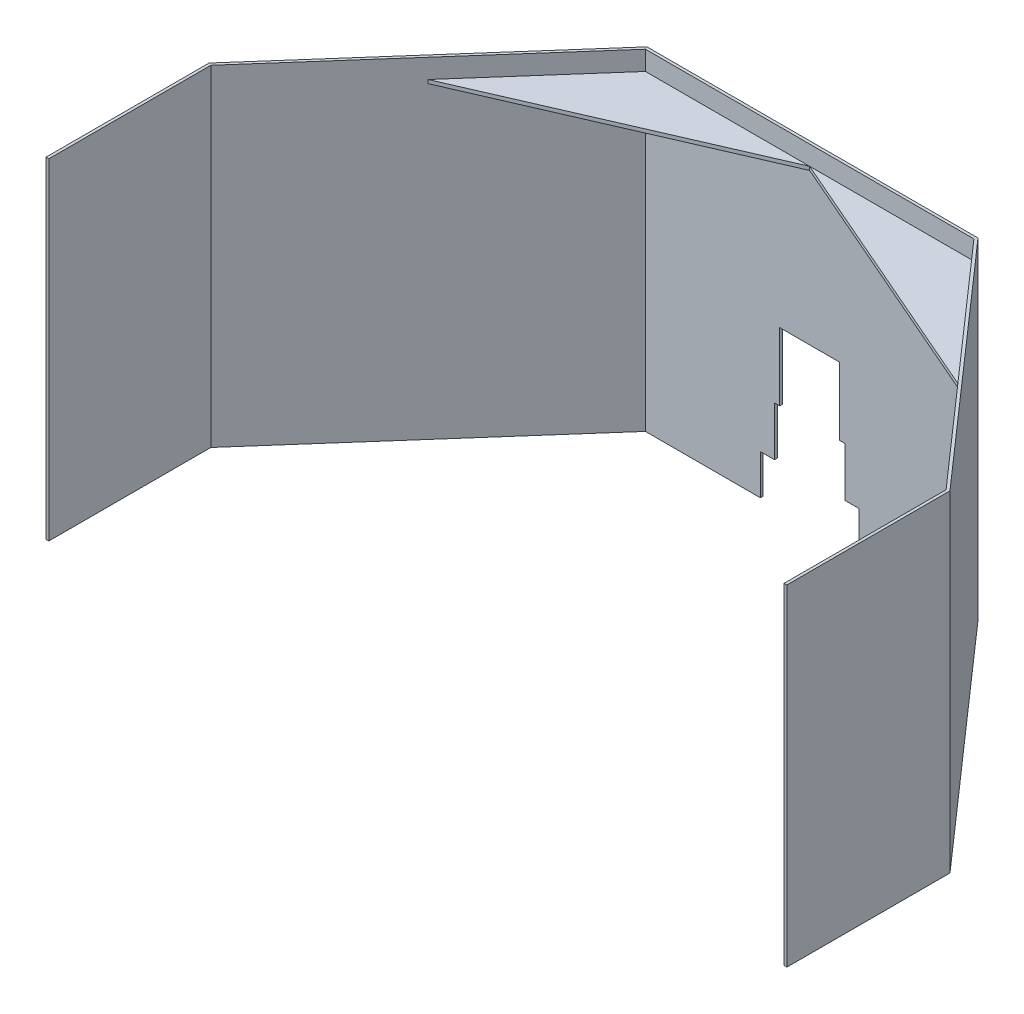
from build123d import *

# Parameters (mm, degrees)
BOSS_EXTRUDE5_DEPTH = 234.9999999
SKETCH4_W           = 42.5
SKETCH4_H           = 48.09999997
CUT_EXTRUDE1_DEPTH  = 2.000000064
RIB1_REACH          = 504.592
SKETCH9_WALLS_W     = 1213.053497679
SKETCH9_WALLS_H     = 2.54
RIB2_REACH          = 504.592
SKETCH8_WALLS_W     = 1213.053497679
SKETCH8_WALLS_H     = 2.54


with BuildPart() as part:
    # Sketch1 → Boss-Extrude5 (new body)
    with BuildSketch(Plane(origin=(0, 0, 0), x_dir=(1, 0, 0), z_dir=(0, 1, 0))):
        Polygon((-117.504462868, 326.155640462), (117.504462868, 326.155640462), (263.000000064, 160.754471715), (263.000000064, 45.003453118), (261, 45.003453118), (261, 160), (116.600094822, 324.155640398), (-116.600094822, 324.155640398), (-261, 160), (-261, 45.001214275), (-263.000000064, 45.001214275), (-263.000000064, 160.754471715), align=None)
    extrude(amount=BOSS_EXTRUDE5_DEPTH)

    # Sketch4 → Cut-Extrude1 (cut)
    with BuildSketch(Plane(origin=(0, 0, -326.155640462), x_dir=(-1, 0, 0), z_dir=(0, 0, -1))):
        with Locations((0, 87.449999931)):
            Rectangle(SKETCH4_W, SKETCH4_H)
        Polygon((-25, 63.399999946), (-25, 28.4), (25, 28.4), (25, 63.399999946), (21.25, 63.399999946), (-21.25, 63.399999946), align=None)
        Polygon((-25, 28.4), (-35, 28.4), (-35, 0), (35, 0), (35, 28.4), (25, 28.4), align=None)
    extrude(amount=-CUT_EXTRUDE1_DEPTH, mode=Mode.SUBTRACT)

    # Sketch9 walls → Rib1 (add, up to next)
    with BuildSketch(Plane(origin=(118.5216607, 0, -272.630231957), x_dir=(0.917086319794662, 0, 0.39868870318267463), z_dir=(-0.39868870318267463, 0, 0.917086319794662)), mode=Mode.PRIVATE) as rib1_sk1:
        with Locations((-26.302471723, 220.03320014)):
            Rectangle(SKETCH9_WALLS_W, SKETCH9_WALLS_H)
    rib1_tool1 = extrude(rib1_sk1.sketch, amount=-RIB1_REACH, mode=Mode.PRIVATE) - part.part
    add(rib1_tool1.solids().sort_by_distance((94.400023705, 220.03320014, -283.116730299))[0])

    # Sketch8 walls → Rib2 (add, up to next)
    with BuildSketch(Plane(origin=(-118.5216607, 0, -272.630231957), x_dir=(0.9170863197945202, 0, -0.39868870318300126), z_dir=(0.3986887031830012, 0, 0.91708631979452)), mode=Mode.PRIVATE) as rib2_sk1:
        with Locations((26.302471723, 220.03320014)):
            Rectangle(SKETCH8_WALLS_W, SKETCH8_WALLS_H)
    rib2_tool1 = extrude(rib2_sk1.sketch, amount=-RIB2_REACH, mode=Mode.PRIVATE) - part.part
    add(rib2_tool1.solids().sort_by_distance((-94.400023705, 220.03320014, -283.116730299))[0])


solid = part.part
